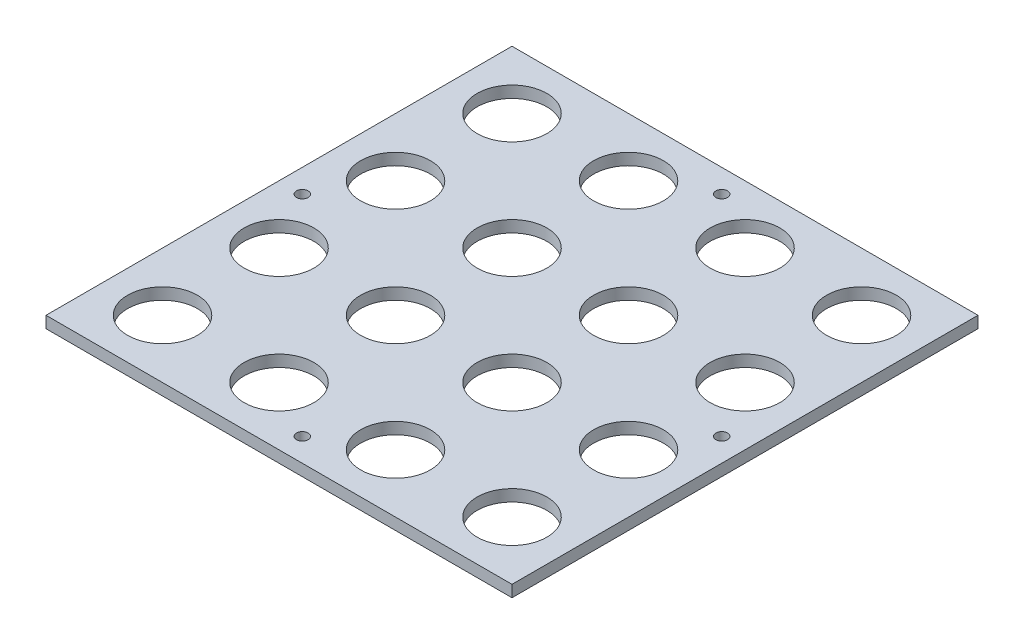
from build123d import *

# Parameters (mm, degrees)
SKETCH1_W           = 254
SKETCH1_H           = 254
SKETCH1_R           = 19
SKETCH1_R_2         = 3.175
BOSS_EXTRUDE2_DEPTH = 6.35


with BuildPart() as part:
    # Sketch1 → Boss-Extrude2 (new body)
    with BuildSketch(Plane(origin=(0, 0, 0), x_dir=(1, 0, 0), z_dir=(0, 1, 0))):
        Rectangle(SKETCH1_W, SKETCH1_H)
        with Locations(Location((-95.25, 95.25, 0), (0, 0, 270))):
            Circle(SKETCH1_R, mode=Mode.SUBTRACT)
        with Locations(Location((-31.75, 95.25, 0), (0, 0, 270))):
            Circle(SKETCH1_R, mode=Mode.SUBTRACT)
        with Locations(Location((31.75, 95.25, 0), (0, 0, 270))):
            Circle(SKETCH1_R, mode=Mode.SUBTRACT)
        with Locations(Location((95.25, 95.25, 0), (0, 0, 270))):
            Circle(SKETCH1_R, mode=Mode.SUBTRACT)
        with Locations(Location((-31.75, 31.75, 0), (0, 0, 270))):
            Circle(SKETCH1_R, mode=Mode.SUBTRACT)
        with Locations(Location((31.75, 31.75, 0), (0, 0, 270))):
            Circle(SKETCH1_R, mode=Mode.SUBTRACT)
        with Locations(Location((95.25, 31.75, 0), (0, 0, 270))):
            Circle(SKETCH1_R, mode=Mode.SUBTRACT)
        with Locations(Location((-31.75, -31.75, 0), (0, 0, 270))):
            Circle(SKETCH1_R, mode=Mode.SUBTRACT)
        with Locations(Location((31.75, -31.75, 0), (0, 0, 270))):
            Circle(SKETCH1_R, mode=Mode.SUBTRACT)
        with Locations(Location((95.25, -31.75, 0), (0, 0, 270))):
            Circle(SKETCH1_R, mode=Mode.SUBTRACT)
        with Locations(Location((-31.75, -95.25, 0), (0, 0, 270))):
            Circle(SKETCH1_R, mode=Mode.SUBTRACT)
        with Locations(Location((31.75, -95.25, 0), (0, 0, 270))):
            Circle(SKETCH1_R, mode=Mode.SUBTRACT)
        with Locations(Location((95.25, -95.25, 0), (0, 0, 270))):
            Circle(SKETCH1_R, mode=Mode.SUBTRACT)
        with Locations(Location((-95.25, 31.75, 0), (0, 0, 270))):
            Circle(SKETCH1_R, mode=Mode.SUBTRACT)
        with Locations(Location((-95.25, -31.75, 0), (0, 0, 270))):
            Circle(SKETCH1_R, mode=Mode.SUBTRACT)
        with Locations(Location((-95.25, -95.25, 0), (0, 0, 270))):
            Circle(SKETCH1_R, mode=Mode.SUBTRACT)
        with Locations(Location((-114.3, 0, 0), (0, 0, 270))):
            Circle(SKETCH1_R_2, mode=Mode.SUBTRACT)
        with Locations(Location((114.3, 0, 0), (0, 0, 270))):
            Circle(SKETCH1_R_2, mode=Mode.SUBTRACT)
        with Locations(Location((0, 114.3, 0), (0, 0, 270))):
            Circle(SKETCH1_R_2, mode=Mode.SUBTRACT)
        with Locations(Location((0, -114.3, 0), (0, 0, 270))):
            Circle(SKETCH1_R_2, mode=Mode.SUBTRACT)
    extrude(amount=BOSS_EXTRUDE2_DEPTH)


solid = part.part
